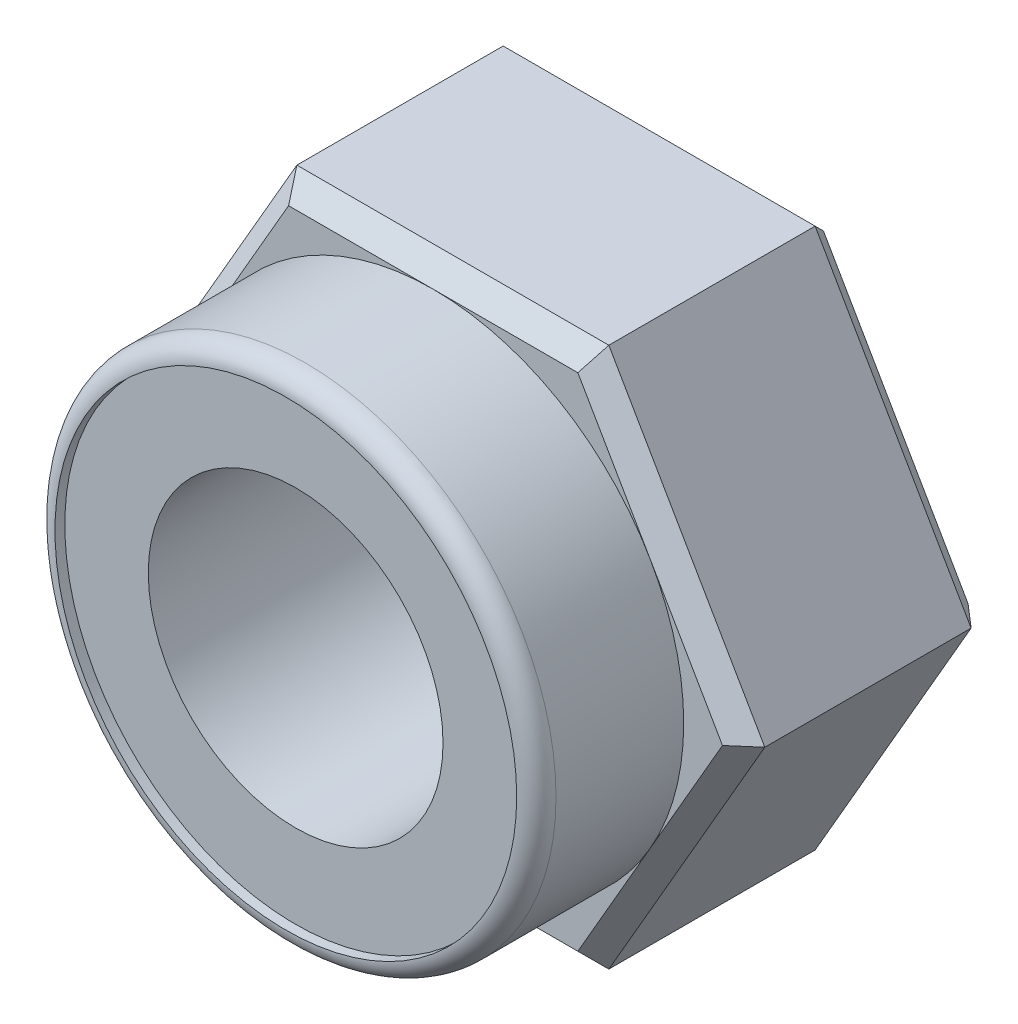
from build123d import *

# Parameters (mm, degrees)
SKETCH1_R           = 1.5
SHAPE_DEPTH         = 2.5
CHAMFER_2_SIZE      = 0.2
SKETCH2_R           = 2.55
SKETCH2_R_2         = 1.5
BOSS_EXTRUDE2_DEPTH = 1.5
FILLET1_R           = 0.2
CUT_EXTRUDE1_START  = -0.1
SKETCH3_R           = 2.35
SKETCH3_R_2         = 1.5
CUT_EXTRUDE1_DEPTH  = 0.1


with BuildPart() as part:
    # Sketch1 → Shape (new body)
    with BuildSketch(Plane.XY):
        Polygon((-1.58771324, -2.75), (1.58771324, -2.75), (3.175426481, 0), (1.58771324, 2.75), (-1.58771324, 2.75), (-3.175426481, 0), align=None)
        Circle(SKETCH1_R, mode=Mode.SUBTRACT)
    extrude(amount=SHAPE_DEPTH)

    # Chamfer 2
    chamfer_2_edges = [part.edges().sort_by_distance(p)[0] for p in [
        (2.38156986, -1.375, 2.5),
        (2.38156986, 1.375, 2.5),
        (0, 2.75, 2.5),
        (-2.38156986, 1.375, 2.5),
        (-2.38156986, -1.375, 2.5),
        (-2.38156986, 1.375, 0),
        (0, 2.75, 0),
        (2.38156986, 1.375, 0),
        (0, -2.75, 2.5),
        (2.38156986, -1.375, 0),
        (0, -2.75, 0),
        (-2.38156986, -1.375, 0),
    ]]
    chamfer(chamfer_2_edges, length=CHAMFER_2_SIZE)

    # Sketch2 → Boss-Extrude2 (add)
    with BuildSketch(Plane.XY.offset(2.5)):
        with Locations(Location((0, 0, 0), (0, 0, 150))):
            Circle(SKETCH2_R)
        Circle(SKETCH2_R_2, mode=Mode.SUBTRACT)
    extrude(amount=BOSS_EXTRUDE2_DEPTH)

    # Fillet1
    fillet1_edges = [part.edges().sort_by_distance(p)[0] for p in [
        (2.20836478, -1.275, 4),
    ]]
    fillet(fillet1_edges, radius=FILLET1_R)

    # Sketch3 → Cut-Extrude1 (cut)
    with BuildSketch(Plane.XY.offset(4).offset(CUT_EXTRUDE1_START)):
        Circle(SKETCH3_R)
        Circle(SKETCH3_R_2, mode=Mode.SUBTRACT)
    extrude(amount=CUT_EXTRUDE1_DEPTH, mode=Mode.SUBTRACT)


solid = part.part
